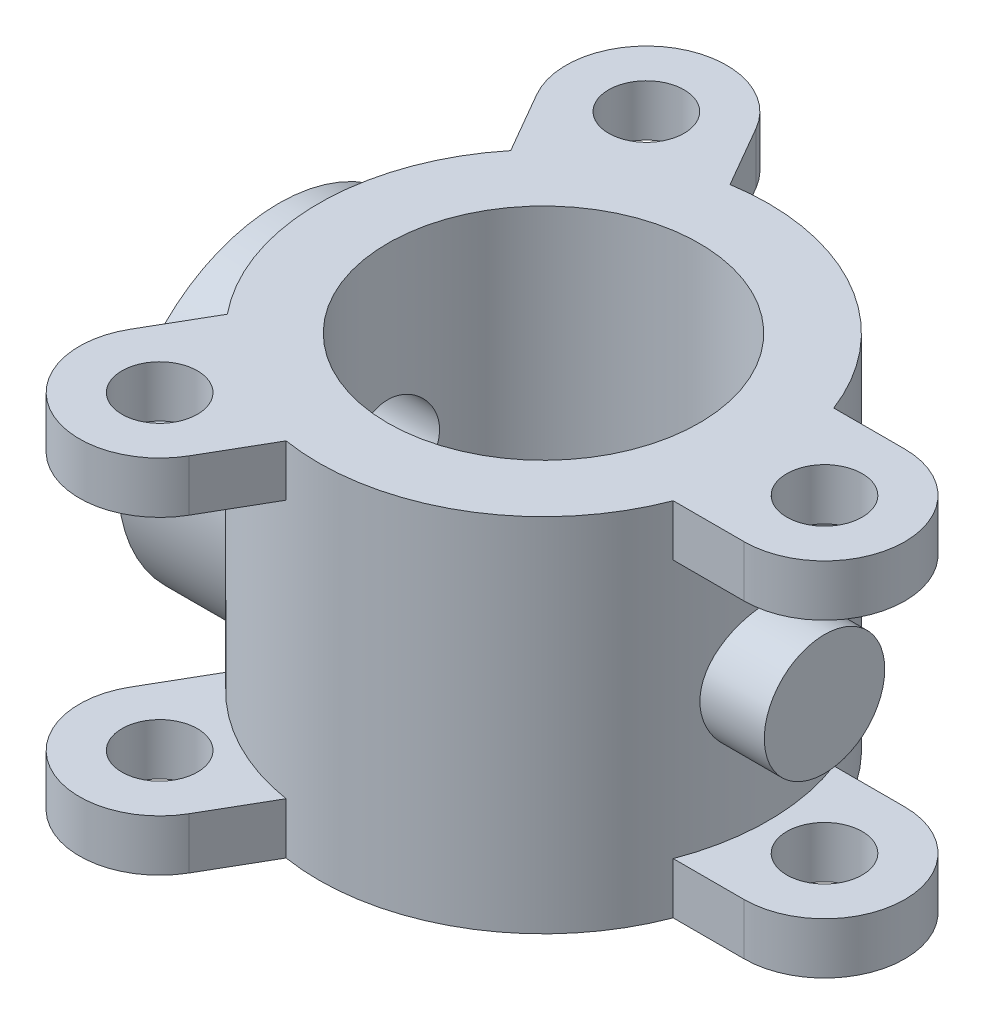
from build123d import *

# Parameters (mm, degrees)
SKETCH1_R                = 140
SKETCH1_R_2              = 97
BOSS_EXTRUDE1_DEPTH      = 112.5
SKETCH2_R                = 23.5
BOSS_EXTRUDE2_DEPTH      = 32
CIRPATTERN1_COUNT        = 3
MIRROR1_COPY_1_SKETCH_R  = 23.5
MIRROR1_COPY_1_DEPTH     = 32
MIRROR1_COPY_2_SKETCH_R  = 23.5
MIRROR1_COPY_2_DEPTH     = 32
BOSS_EXTRUDE3_REACH      = 489.344
BOSS_EXTRUDE3_END_RADIUS = 140
BOSS_EXTRUDE3_START      = -165
SKETCH3_R                = 100
BOSS_EXTRUDE4_REACH      = 499.344
BOSS_EXTRUDE4_END_RADIUS = 140
BOSS_EXTRUDE4_START      = 175
SKETCH4_R                = 37.5
SKETCH5_R                = 50
CUT_EXTRUDE1_DEPTH       = 25
SKETCH6_R                = 28.1
CUT_EXTRUDE2_DEPTH       = 310
SKETCH9_R                = 10.15
CUT_EXTRUDE3_DEPTH       = 15
CIRPATTERN2_COUNT        = 3


with BuildPart() as part:
    # Sketch1 → Boss-Extrude1 (new, symmetric)
    with BuildSketch(Plane(origin=(0, 0, 0), x_dir=(1, 0, 0), z_dir=(0, 1, 0))):
        with Locations(Location((0, 0, 0), (0, 0, 270))):
            Circle(SKETCH1_R)
        with Locations(Location((0, 0, 0), (0, 0, 270))):
            Circle(SKETCH1_R_2, mode=Mode.SUBTRACT)
    extrude(amount=BOSS_EXTRUDE1_DEPTH, both=True)

    # Sketch2 → Boss-Extrude2 (add)
    with BuildSketch(Plane(origin=(0, 112.5, 0), x_dir=(1, 0, 0), z_dir=(0, 1, 0))):
        with BuildLine():
            Line((175, 50), (130.766968306, 50))
            ThreePointArc((130.766968306, 50), (140, 0), (130.766968306, -50))
            Line((130.766968306, -50), (175, -50))
            ThreePointArc((175, -50), (225, 0), (175, 50))
        make_face()
        with Locations(Location((175, 0, 0), (0, 0, 270))):
            Circle(SKETCH2_R, mode=Mode.SUBTRACT)
    boss_extrude2 = extrude(amount=-BOSS_EXTRUDE2_DEPTH)

    # CirPattern1: Boss-Extrude2 ×3 about axis
    cirpattern1_axis = Axis((0, 0, 0), (0, 1, 0))
    for i in range(1, CIRPATTERN1_COUNT):
        add(boss_extrude2.rotate(cirpattern1_axis, i * 360 / CIRPATTERN1_COUNT))

    # Mirror1: Boss-Extrude2 across plane
    add(boss_extrude2.mirror(Plane.ZX))

    # Mirror1 copy 1 sketch → Mirror1 copy 1 (add)
    with BuildSketch(Plane(origin=(0, -112.5, 0), x_dir=(-0.4999999999999998, 0, -0.8660254037844387), z_dir=(0, -1, 0))):
        with BuildLine():
            Line((175, -50), (130.766968306, -50))
            ThreePointArc((130.766968306, -50), (140, 0), (130.766968306, 50))
            Line((130.766968306, 50), (175, 50))
            ThreePointArc((175, 50), (225, 0), (175, -50))
        make_face()
        with Locations((175, 0)):
            Circle(MIRROR1_COPY_1_SKETCH_R, mode=Mode.SUBTRACT)
    extrude(amount=-MIRROR1_COPY_1_DEPTH)

    # Mirror1 copy 2 sketch → Mirror1 copy 2 (add)
    with BuildSketch(Plane(origin=(0, -112.5, 0), x_dir=(-0.5000000000000004, 0, 0.8660254037844384), z_dir=(0, -1, 0))):
        with BuildLine():
            Line((175, -50), (130.766968306, -50))
            ThreePointArc((130.766968306, -50), (140, 0), (130.766968306, 50))
            Line((130.766968306, 50), (175, 50))
            ThreePointArc((175, 50), (225, 0), (175, -50))
        make_face()
        with Locations((175, 0)):
            Circle(MIRROR1_COPY_2_SKETCH_R, mode=Mode.SUBTRACT)
    extrude(amount=-MIRROR1_COPY_2_DEPTH)

    # Boss-Extrude3: up to this cylinder (the profile starts outside it)
    boss_extrude3_end = Plane(origin=(0, 0, 0), z_dir=(0, -1, 0)) * Cylinder(BOSS_EXTRUDE3_END_RADIUS, 1259.688, mode=Mode.PRIVATE)
    # Sketch3 → Boss-Extrude3 (add, up to the surface)
    with BuildSketch(Plane(origin=(0, 0, 0), x_dir=(0, 0, -1), z_dir=(1, 0, 0)).offset(BOSS_EXTRUDE3_START), mode=Mode.PRIVATE) as boss_extrude3_sk1:
        with Locations(Location((0, 0, 0), (0, 0, 180))):
            Circle(SKETCH3_R)
    boss_extrude3_tool1 = extrude(boss_extrude3_sk1.sketch, amount=BOSS_EXTRUDE3_REACH, mode=Mode.PRIVATE) - boss_extrude3_end
    add(boss_extrude3_tool1.solids().sort_by_distance((-165, 0, 0))[0])

    # Boss-Extrude4: up to this cylinder (the profile starts outside it)
    boss_extrude4_end = Plane(origin=(0, 0, 0), z_dir=(0, -1, 0)) * Cylinder(BOSS_EXTRUDE4_END_RADIUS, 1279.688, mode=Mode.PRIVATE)
    # Sketch4 → Boss-Extrude4 (add, up to the surface)
    with BuildSketch(Plane(origin=(0, 0, 0), x_dir=(0, 0, -1), z_dir=(1, 0, 0)).offset(BOSS_EXTRUDE4_START), mode=Mode.PRIVATE) as boss_extrude4_sk1:
        Circle(SKETCH4_R)
    boss_extrude4_tool1 = extrude(boss_extrude4_sk1.sketch, amount=-BOSS_EXTRUDE4_REACH, mode=Mode.PRIVATE) - boss_extrude4_end
    add(boss_extrude4_tool1.solids().sort_by_distance((175, 0, 0))[0])

    # Sketch5 → Cut-Extrude1 (cut)
    with BuildSketch(Plane.ZY.offset(165)):
        Circle(SKETCH5_R)
    extrude(amount=-CUT_EXTRUDE1_DEPTH, mode=Mode.SUBTRACT)

    # Sketch6 → Cut-Extrude2 (cut)
    with BuildSketch(Plane.ZY.offset(165)):
        Circle(SKETCH6_R)
    extrude(amount=-CUT_EXTRUDE2_DEPTH, mode=Mode.SUBTRACT)

    # Sketch9 → Cut-Extrude3 (cut)
    with BuildSketch(Plane.ZY.offset(165)):
        with Locations((0, 75)):
            Circle(SKETCH9_R)
    cut_extrude3 = extrude(amount=-CUT_EXTRUDE3_DEPTH, mode=Mode.SUBTRACT)

    # CirPattern2: Cut-Extrude3 ×3 about axis
    cirpattern2_axis = Axis((0, 0, 0), (1, 0, 0))
    for i in range(1, CIRPATTERN2_COUNT):
        add(cut_extrude3.rotate(cirpattern2_axis, i * 360 / CIRPATTERN2_COUNT), mode=Mode.SUBTRACT)


solid = part.part
